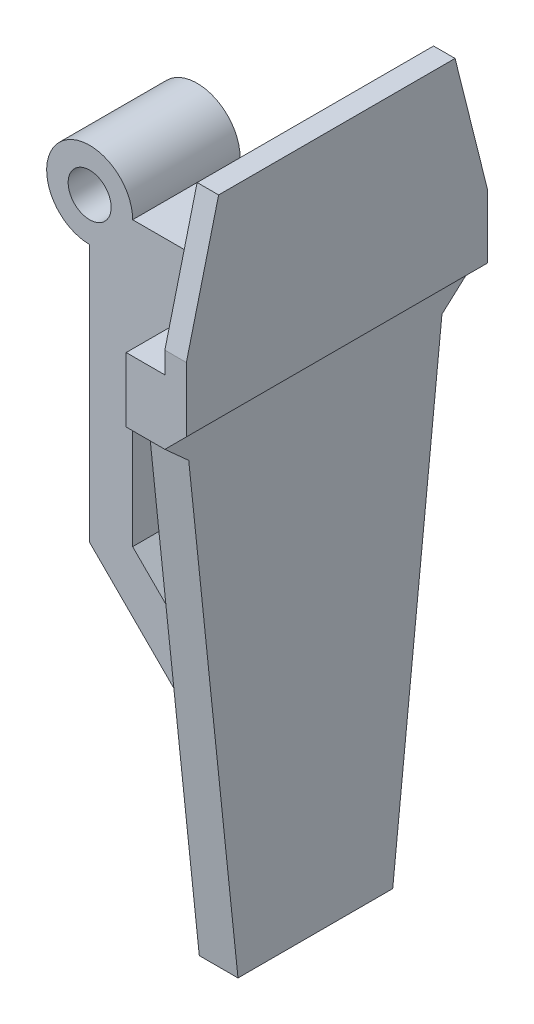
from build123d import *

# Parameters (mm, degrees)
EXTRUDE_1_DEPTH          = 2.5
EXTRUDE_1_DEPTH_BACK     = 2.5
EXTRUDE_2_DEPTH          = 3
EXTRUDE_3_DEPTH          = 1.8
CUT_EXTRUDE_1_DEPTH      = 72.103790411
CUT_EXTRUDE_1_DEPTH_BACK = 72.103790411
CUT_EXTRUDE_2_DEPTH      = 30.885943266
CUT_EXTRUDE_3_DEPTH      = 10
SKETCH_8_R               = 1
CUT_EXTRUDE_4_DEPTH      = 70.182991672


with BuildPart() as part:
    # 草图1 → 凸台-拉伸1 (new, two sides: drawn at the far end of the back side and taken through both)
    with BuildSketch(Plane.XY.offset(-EXTRUDE_1_DEPTH_BACK)):
        with BuildLine():
            ThreePointArc((56.288432405, 0.720527774), (52.874218842, 2.134741337), (54.288432405, -1.279472226))
            Line((54.288432405, -1.279472226), (54.288432405, -13.279472226))
            Line((54.288432405, -13.279472226), (62.288432405, -21.279472226))
            Line((62.288432405, -21.279472226), (62.288432405, 0.720527774))
            Line((62.288432405, 0.720527774), (56.288432405, 0.720527774))
        make_face()
        Polygon((56.288432405, -12.451045101), (56.288432405, -5.279472226), (60.288432405, -1.279472226), (60.288432405, -16.451045101), align=None, mode=Mode.SUBTRACT)
    extrude(amount=EXTRUDE_1_DEPTH + EXTRUDE_1_DEPTH_BACK)

    # 草图2 → 凸台-拉伸2 (add)
    with BuildSketch(Plane(origin=(62.288432405, 0, 0), x_dir=(0, 0, -1), z_dir=(1, 0, 0))):
        Polygon((-7, -3.279472226), (-4.5, -27.279472226), (4.5, -27.279472226), (7, -3.279472226), (7, 8.720527774), (-7, 8.720527774), align=None)
    extrude(amount=EXTRUDE_2_DEPTH)

    # 草图4 → 凸台-拉伸3 (add)
    with BuildSketch(Plane.ZY.offset(-62.288432405)):
        Polygon((-7, -0.279472226), (-7, -3.279472226), (-4.5, -27.279472226), (4.5, -27.279472226), (7, -3.279472226), (7, -0.279472226), align=None)
    extrude(amount=EXTRUDE_3_DEPTH)

    # 草图5 → 切除-拉伸1 (cut, two sides: drawn at the far end of the back side and taken through both)
    with BuildSketch(Plane.XY.offset(-CUT_EXTRUDE_1_DEPTH_BACK)):
        Polygon((62.288432405, -27.279472226), (62.288432405, -3.279472226), (63.288432405, -2.279472226), (63.288432405, 6.720527774), (62.288432405, 6.720527774), (62.288432405, 8.720527774), (65.288432405, 8.720527774), (65.288432405, -27.279472226), align=None)
    extrude(amount=CUT_EXTRUDE_1_DEPTH + CUT_EXTRUDE_1_DEPTH_BACK, mode=Mode.SUBTRACT)

    # 草图6 → 切除-拉伸2 (cut, through all)
    with BuildSketch(Plane(origin=(62.288432405, 0, 0), x_dir=(0, 0, -1), z_dir=(1, 0, 0))):
        Polygon((-7, -3.279472226), (-4.5, -27.279472226), (4.5, -27.279472226), (7, -3.279472226), (5.890422624, -4.279472226), (3.598755957, -26.279472226), (-3.598755957, -26.279472226), (-5.890422624, -4.279472226), align=None)
    extrude(amount=-CUT_EXTRUDE_2_DEPTH, mode=Mode.SUBTRACT)

    # 草图7 → 切除-拉伸3 (cut)
    with BuildSketch(Plane(origin=(63.288432405, 0, 0), x_dir=(0, 0, -1), z_dir=(1, 0, 0))):
        Polygon((-7, 0.720527774), (-5.5, 6.720527774), (-7, 6.720527774), align=None)
        Polygon((5.5, 6.720527774), (7, 6.720527774), (7, 0.720527774), align=None)
    extrude(amount=-CUT_EXTRUDE_3_DEPTH, mode=Mode.SUBTRACT)

    # 草图8 → 切除-拉伸4 (cut, through all)
    with BuildSketch(Plane.XY.offset(2.5)):
        with Locations((54.288432405, 0.720527774)):
            Circle(SKETCH_8_R)
    extrude(amount=-CUT_EXTRUDE_4_DEPTH, mode=Mode.SUBTRACT)


solid = part.part
